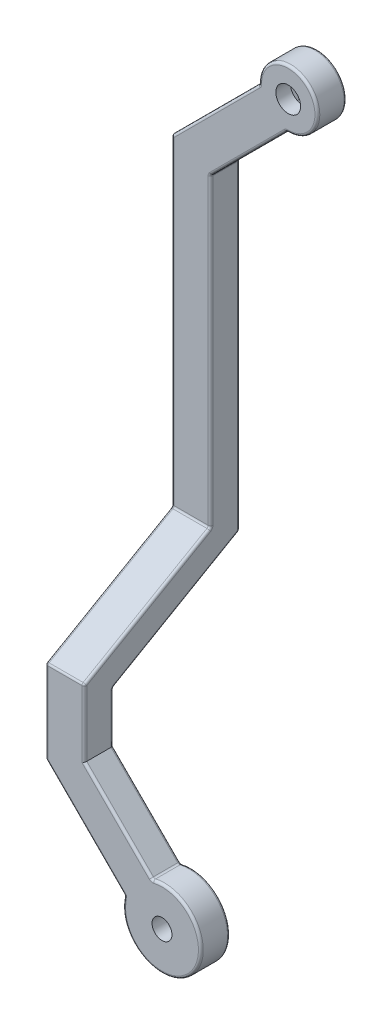
from build123d import *

# Parameters (mm, degrees)
EXTRUDE_1_DEPTH          = 16
SKETCH_2_R               = 2.05
SKETCH_2_R_2             = 2.55
CUT_EXTRUDE_1_DEPTH      = 147.563979204
CUT_EXTRUDE_2_DEPTH      = 144.920116731
CUT_EXTRUDE_2_DEPTH_BACK = 144.920116731
CUT_EXTRUDE_3_DEPTH      = 3
CUT_EXTRUDE_5_DEPTH      = 3
FILLET_1_R               = 0.5


with BuildPart() as part:
    # 草图1 → 凸台-拉伸1 (new, symmetric)
    with BuildSketch(Plane.XY):
        with BuildLine():
            Line((-5.990704785, 134.666149465), (-24, 116.656854249))
            Line((-24, 116.656854249), (-24, 18.343145751))
            Line((-24, 18.343145751), (-7.72740661, 2.070552361))
            ThreePointArc((-7.72740661, 2.070552361), (5.656854249, -5.656854249), (-2.070552361, 7.72740661))
            Line((-2.070552361, 7.72740661), (-16, 21.656854249))
            Line((-16, 21.656854249), (-16, 113.343145751))
            Line((-16, 113.343145751), (-0.333850535, 129.009295215))
            ThreePointArc((-0.333850535, 129.009295215), (4.242640687, 139.242640687), (-5.990704785, 134.666149465))
        make_face()
    extrude(amount=EXTRUDE_1_DEPTH, both=True)

    # 草图2 → 切除-拉伸1 (cut, through all)
    with BuildSketch(Plane.XY.offset(16)):
        Circle(SKETCH_2_R)
        with Locations((0, 135)):
            Circle(SKETCH_2_R_2)
    extrude(amount=-CUT_EXTRUDE_1_DEPTH, mode=Mode.SUBTRACT)

    # 草图4 → 切除-拉伸2 (cut, two sides: drawn at the far end of the back side and taken through both)
    with BuildSketch(Plane(origin=(0, 0, 0), x_dir=(0, 0, -1), z_dir=(1, 0, 0)).offset(-CUT_EXTRUDE_2_DEPTH_BACK)):
        Polygon((16, 47.011106999), (-10, 32), (-10, -8), (16, -8), align=None)
        Polygon((-16, 35.464101615), (10, 50.475208614), (10, 141), (-16, 141), align=None)
    extrude(amount=CUT_EXTRUDE_2_DEPTH + CUT_EXTRUDE_2_DEPTH_BACK, mode=Mode.SUBTRACT)

    # 草图5 → 切除-拉伸3 (cut)
    with BuildSketch(Plane(origin=(0, 0, 10), x_dir=(-1, 0, 0), z_dir=(0, 0, -1))):
        Polygon((1.58771324, -2.75), (3.175426481, 0), (1.58771324, 2.75), (-1.58771324, 2.75), (-3.175426481, 0), (-1.58771324, -2.75), align=None)
    extrude(amount=-CUT_EXTRUDE_3_DEPTH, mode=Mode.SUBTRACT)

    # 草图7 → 切除-拉伸5 (cut)
    with BuildSketch(Plane(origin=(0, 0, -16), x_dir=(-1, 0, 0), z_dir=(0, 0, -1))):
        Polygon((3.175426481, 135), (1.58771324, 137.75), (-1.58771324, 137.75), (-3.175426481, 135), (-1.58771324, 132.25), (1.58771324, 132.25), align=None)
    extrude(amount=-CUT_EXTRUDE_5_DEPTH, mode=Mode.SUBTRACT)

    # 圆角1
    fillet_1_edges = [part.edges().sort_by_distance(p)[0] for p in [
        (-14.995352392, 125.661501857, -10),
        (-15.863703305, 10.206849056, 16),
        (-9.03527618, 14.69213043, 10),
        (4.242640687, 139.242640687, -10),
        (-14.995352392, 125.661501857, -16),
        (5.656854249, -5.656854249, 16),
        (5.656854249, -5.656854249, 10),
        (-24, 25.171572875, 10),
        (-16, 26.828427125, 10),
        (-8.166925268, 121.176220483, -10),
        (-16, 42.969655115, 3),
        (-8.166925268, 121.176220483, -16),
        (4.242640687, 139.242640687, -16),
        (-9.03527618, 14.69213043, 16),
        (-15.863703305, 10.206849056, 10),
        (-24, 39.505553499, -3),
        (-16, 39.505553499, -3),
        (-16, 81.909177182, -10),
        (-24, 81.833980624, -16),
        (-16, 80.177126375, -16),
        (-0.333850535, 129.009295215, -13),
        (-16, 113.343145751, -13),
        (-2.070552361, 7.72740661, 13),
        (-7.72740661, 2.070552361, 13),
        (-20, 47.011106999, -16),
        (-20, 32, 10),
        (-24, 18.343145751, 13),
        (-20, 35.464101615, 16),
        (-20, 50.475208614, -10),
        (-24, 116.656854249, -13),
        (-5.990704785, 134.666149465, -13),
        (-24, 83.566031432, -10),
        (-24, 42.969655115, 3),
        (-16, 28.560477932, 16),
        (-24, 26.903623683, 16),
    ]]
    fillet(fillet_1_edges, radius=FILLET_1_R)


solid = part.part
